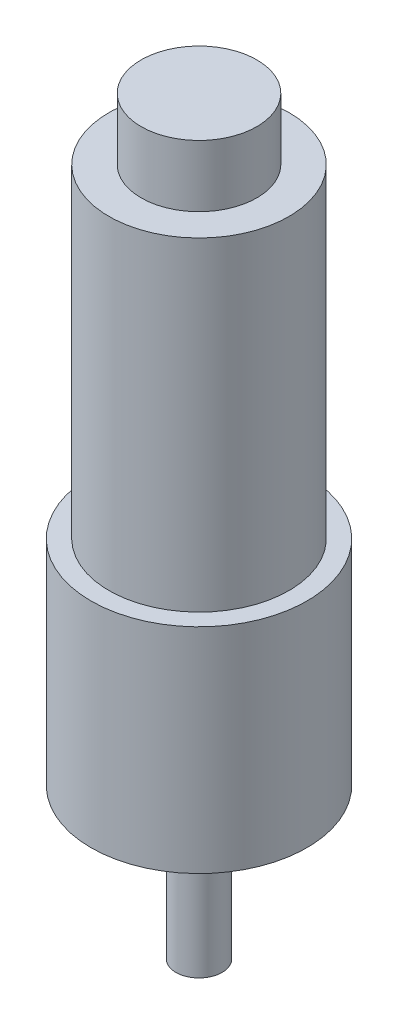
from build123d import *

# Parameters (mm, degrees)
SKETCH_1_R          = 14
EXTRUDE_1_DEPTH     = 27.7
SKETCH_3_R          = 11.669632126
EXTRUDE_2_DEPTH     = 42
SKETCH_8_R          = 7.5
EXTRUDE_4_DEPTH     = 8
SKETCH_9_R          = 8
EXTRUDE_5_DEPTH     = 1
SKETCH_5_R          = 3
EXTRUDE_3_DEPTH     = 18.5
CUT_EXTRUDE_START   = -12
CUT_EXTRUDE_2_DEPTH = 12
SKETCH_4_R          = 1.5
CUT_EXTRUDE_1_DEPTH = 4


with BuildPart() as part:
    # 草图1 → 凸台-拉伸1 (new body)
    with BuildSketch(Plane(origin=(0, 0, 0), x_dir=(1, 0, 0), z_dir=(0, 1, 0))):
        with Locations(Location((0, 0, 0), (0, 0, 270))):
            Circle(SKETCH_1_R)
    extrude(amount=EXTRUDE_1_DEPTH)

    # 草图3 → 凸台-拉伸2 (add)
    with BuildSketch(Plane(origin=(0, 27.7, 0), x_dir=(1, 0, 0), z_dir=(0, 1, 0))):
        with Locations(Location((0, 0, 0), (0, 0, 90))):
            Circle(SKETCH_3_R)
    extrude(amount=EXTRUDE_2_DEPTH)

    # 草图8 → 凸台-拉伸4 (add)
    with BuildSketch(Plane(origin=(0, 69.7, 0), x_dir=(1, 0, 0), z_dir=(0, 1, 0))):
        with Locations(Location((0, 0, 0), (0, 0, 270))):
            Circle(SKETCH_8_R)
    extrude(amount=EXTRUDE_4_DEPTH)

    # 草图9 → 凸台-拉伸5 (add)
    with BuildSketch(Plane.XZ):
        with Locations(Location((0, 0, 0), (0, 0, 90))):
            Circle(SKETCH_9_R)
    extrude(amount=EXTRUDE_5_DEPTH)

    # 草图5 → 凸台-拉伸3 (add)
    with BuildSketch(Plane.XZ.offset(1)):
        with Locations(Location((0, 0, 0), (0, 0, 270))):
            Circle(SKETCH_5_R)
    extrude(amount=EXTRUDE_3_DEPTH)

    # 草图7 → 切除-拉伸2 (cut)
    with BuildSketch(Plane.XZ.offset(19.5).offset(CUT_EXTRUDE_START)):
        with BuildLine():
            Line((-1.658312395, -2.5), (1.658312395, -2.5))
            ThreePointArc((1.658312395, -2.5), (0, -3), (-1.658312395, -2.5))
        make_face()
    extrude(amount=CUT_EXTRUDE_2_DEPTH, mode=Mode.SUBTRACT)

    # 草图4 → 切除-拉伸1 (cut)
    with BuildSketch(Plane.XZ):
        with Locations(Location((0, 11, 0), (0, 0, 270))):
            Circle(SKETCH_4_R)
        with Locations(Location((11, 0, 0), (0, 0, 270))):
            Circle(SKETCH_4_R)
        with Locations(Location((0, -11, 0), (0, 0, 270))):
            Circle(SKETCH_4_R)
        with Locations(Location((-11, 0, 0), (0, 0, 270))):
            Circle(SKETCH_4_R)
    extrude(amount=-CUT_EXTRUDE_1_DEPTH, mode=Mode.SUBTRACT)


solid = part.part
